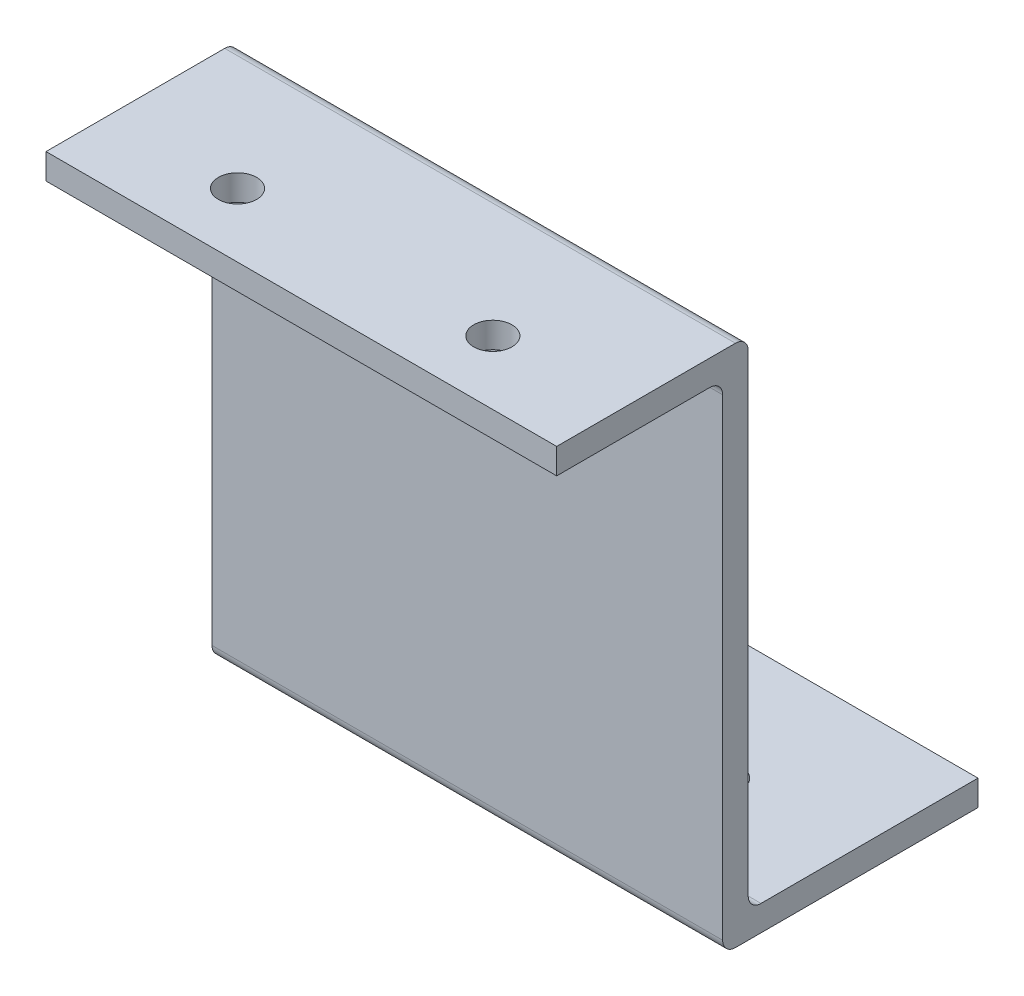
from build123d import *

# Parameters (mm, degrees)
SKETCH1_W           = 13
SKETCH1_H           = 2
SKETCH1_W_2         = 2
SKETCH1_H_2         = 37
SKETCH1_W_3         = 18
BOSS_EXTRUDE1_DEPTH = 40
SKETCH2_R           = 1.5
CUT_EXTRUDE1_DEPTH  = 40
FILLET1_R           = 1
SKETCH4_R           = 1.5
CUT_EXTRUDE2_DEPTH  = 40


with BuildPart() as part:
    # Sketch1 → Boss-Extrude1 (new body)
    with BuildSketch(Plane(origin=(0, 0, 0), x_dir=(0, 0, -1), z_dir=(1, 0, 0))):
        with Locations((6.5, 1)):
            Rectangle(SKETCH1_W, SKETCH1_H)
        with Locations((14, 1)):
            Rectangle(SKETCH1_W_2, SKETCH1_H)
        with Locations((14, -18.5)):
            Rectangle(SKETCH1_W_2, SKETCH1_H_2)
        with Locations((24, -38)):
            Rectangle(SKETCH1_W_3, SKETCH1_H)
        with Locations((14, -38)):
            Rectangle(SKETCH1_W_2, SKETCH1_H)
    extrude(amount=BOSS_EXTRUDE1_DEPTH)

    # Sketch2 → Cut-Extrude1 (cut)
    with BuildSketch(Plane(origin=(0, 2, 0), x_dir=(1, 0, 0), z_dir=(0, 1, 0))):
        with Locations(Location((10, 5, 0), (0, 0, 270))):
            Circle(SKETCH2_R)
        with Locations(Location((30, 5, 0), (0, 0, 270))):
            Circle(SKETCH2_R)
    extrude(amount=-CUT_EXTRUDE1_DEPTH, mode=Mode.SUBTRACT)

    # Fillet1
    fillet1_edges = [part.edges().sort_by_distance(p)[0] for p in [
        (20, 2, -15),
        (20, -37, -15),
        (20, -39, -13),
        (20, 0, -13),
    ]]
    fillet(fillet1_edges, radius=FILLET1_R)

    # Sketch4 → Cut-Extrude2 (cut)
    with BuildSketch(Plane(origin=(0, -37, 0), x_dir=(1, 0, 0), z_dir=(0, 1, 0))):
        with Locations(Location((30, 23, 0), (0, 0, 270))):
            Circle(SKETCH4_R)
        with Locations(Location((10, 23, 0), (0, 0, 270))):
            Circle(SKETCH4_R)
    extrude(amount=-CUT_EXTRUDE2_DEPTH, mode=Mode.SUBTRACT)


solid = part.part
